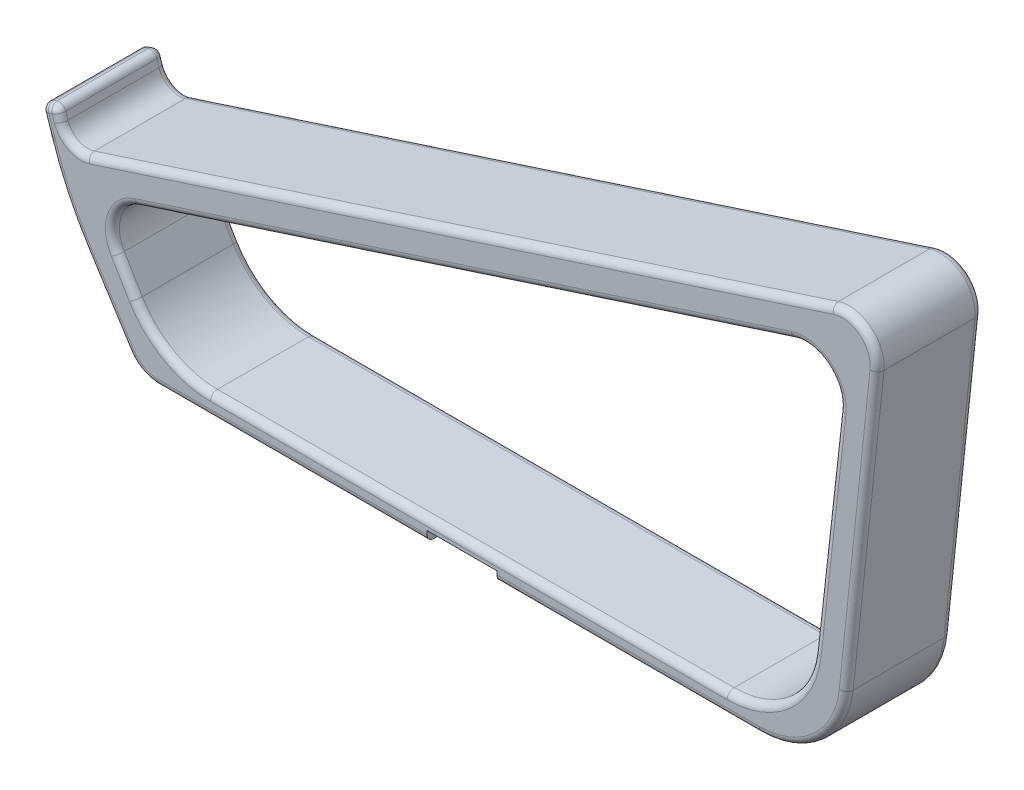
from build123d import *

# Parameters (mm, degrees)
SKETCH2_W           = 250
SKETCH2_H           = 30
BOSS_EXTRUDE1_DEPTH = 10
SKETCH3_W           = 5
SKETCH3_H           = 30
BOSS_EXTRUDE2_DEPTH = 10
SKETCH4_W           = 200
SKETCH4_H           = 30
BOSS_EXTRUDE3_DEPTH = 6
SKETCH11_W          = 30
SKETCH11_H          = 55
CUT_EXTRUDE2_DEPTH  = 10
FILLET1_R           = 25
FILLET9_R           = 10
FILLET8_R           = 10
FILLET11_R          = 25
FILLET5_R           = 6
FILLET10_R          = 100
FILLET6_R           = 2
SKETCH12_W          = 20
SKETCH12_H          = 20
SKETCH12_W_2        = 5
SKETCH12_H_2        = 7.5
CUT_EXTRUDE3_DEPTH  = 3


with BuildPart() as part:
    # Sketch2 → Boss-Extrude1 (new body)
    with BuildSketch(Plane(origin=(-23.43534086, 72.126562752, 0), x_dir=(0.9510565162951534, 0.3090169943749482, 0), z_dir=(-0.3090169943749481, 0.9510565162951533, 0))):
        with Locations((33.98053096, 100)):
            Rectangle(SKETCH2_W, SKETCH2_H)
    extrude(amount=-BOSS_EXTRUDE1_DEPTH)

    # Sketch3 → Boss-Extrude2 (add)
    with BuildSketch(Plane(origin=(-23.43534086, 72.126562752, 0), x_dir=(0.9510565162951534, 0.3090169943749482, 0), z_dir=(-0.3090169943749481, 0.9510565162951533, 0))):
        with Locations((-88.51946904, 100)):
            Rectangle(SKETCH3_W, SKETCH3_H)
    extrude(amount=BOSS_EXTRUDE2_DEPTH)



with BuildPart() as body_2:
    # Sketch4 → Boss-Extrude3 (new body)
    with BuildSketch(Plane(origin=(0, 0, 0), x_dir=(1, 0, 0), z_dir=(0, 1, 0))):
        with Locations((15, 100)):
            Rectangle(SKETCH4_W, SKETCH4_H)
    extrude(amount=BOSS_EXTRUDE3_DEPTH)


with BuildPart() as part_1:
    add(part.part)

    add(body_2.part)  # Loft1 merges body 2
    # Sketch6 → Loft1 section 0
    with BuildSketch(Plane(origin=(-23.43534086, 72.126562752, 0), x_dir=(0.9510565162951534, 0.3090169943749482, 0), z_dir=(0.3090169943749481, -0.9510565162951533, 0))):
        with BuildLine():
            Line((158.98053096, -85), (148.98053096, -85))
            Line((148.98053096, -85), (148.98053096, -115))
            Line((148.98053096, -115), (158.98053096, -115))
            Line((158.98053096, -115), (158.98053096, -85))
        make_face()
    # Sketch5 → Loft1 section 1
    with BuildSketch(Plane(origin=(0, 0, 0), x_dir=(1, 0, 0), z_dir=(0, 1, 0))):
        with BuildLine():
            Line((115, 115), (105, 115))
            Line((105, 115), (105, 85))
            Line((105, 85), (115, 85))
            Line((115, 85), (115, 115))
        make_face()
    loft()

    # Sketch11 → Cut-Extrude2 (cut)
    with BuildSketch(Plane(origin=(113.739623688, -11.973083454, 0), x_dir=(0, 0, -1), z_dir=(0.9945050055104876, -0.1046890348345292, 0))):
        with Locations((100, 135.5)):
            Rectangle(SKETCH11_W, SKETCH11_H)
    extrude(amount=CUT_EXTRUDE2_DEPTH, mode=Mode.SUBTRACT)

    # Sketch9 → Loft2 section 0
    with BuildSketch(Plane(origin=(-20.345170916, 62.615997589, 0), x_dir=(0.9510565162951534, 0.3090169943749482, 0), z_dir=(0.3090169943749481, -0.9510565162951533, 0))):
        with BuildLine():
            Line((-91.01946904, -85), (-81.01946904, -85))
            Line((-81.01946904, -85), (-81.01946904, -115))
            Line((-81.01946904, -115), (-91.01946904, -115))
            Line((-91.01946904, -115), (-91.01946904, -85))
        make_face()
    # Sketch10 → Loft2 section 1
    with BuildSketch(Plane(origin=(0, 0, 0), x_dir=(1, 0, 0), z_dir=(0, 1, 0))):
        with BuildLine():
            Line((-85, 115), (-75, 115))
            Line((-75, 115), (-75, 85))
            Line((-75, 85), (-85, 85))
            Line((-85, 85), (-85, 115))
        make_face()
    loft()

    # Fillet1
    fillet1_edges = [part_1.edges().sort_by_distance(p)[0] for p in [
        (105.672974261, 6, -100),
        (-78.576290654, 6, -100),
    ]]
    fillet(fillet1_edges, radius=FILLET1_R)

    # Fillet9
    fillet9_edges = [part_1.edges().sort_by_distance(p)[0] for p in [
        (127.764129074, 121.254248594, -100),
    ]]
    fillet(fillet9_edges, radius=FILLET9_R)

    # Fillet8
    fillet8_edges = [part_1.edges().sort_by_distance(p)[0] for p in [
        (117.029613529, 107.251770821, -100),
        (-97.399264893, 37.579604781, -100),
        (-85, 0, -100),
    ]]
    fillet(fillet8_edges, radius=FILLET8_R)

    # Fillet11
    fillet11_edges = [part_1.edges().sort_by_distance(p)[0] for p in [
        (115, 0, -100),
    ]]
    fillet(fillet11_edges, radius=FILLET11_R)

    # Fillet5
    fillet5_edges = [part_1.edges().sort_by_distance(p)[0] for p in [
        (-105.244717419, 45.545084972, -100),
    ]]
    fillet(fillet5_edges, radius=FILLET5_R)

    # Fillet10
    fillet10_edges = [part_1.edges().sort_by_distance(p)[0] for p in [
        (-106.909830056, 34.489434837, -100),
    ]]
    fillet(fillet10_edges, radius=FILLET10_R)

    # Fillet6
    fillet6_edges = [part_1.edges().sort_by_distance(p)[0] for p in [
        (9.473412371, 6, -115),
        (9.473412371, 6, -85),
        (-76.722563068, 9.262951119, -85),
        (-76.722563068, 9.262951119, -115),
        (99.983633439, 12.363146047, -85),
        (99.983633439, 12.363146047, -115),
        (121.753976282, 64.160140842, -85),
        (121.753976282, 64.160140842, -115),
        (6.789088019, 81.947075002, -85),
        (122.500555572, 114.755349451, -85),
        (122.500555572, 114.755349451, -115),
        (6.494058609, 0, -85),
        (-88.417020392, 22.509949594, -85),
        (8.392983609, 71.953590028, -85),
        (111.732266775, 60.02250459, -85),
        (-84.320965292, 1.235829976, -85),
        (8.392983609, 71.953590028, -115),
        (-88.417020392, 22.509949594, -115),
        (111.732266775, 60.02250459, -115),
        (-84.320965292, 1.235829976, -115),
        (-91.756560464, 35.458482469, -85),
        (-91.756560464, 35.458482469, -115),
        (111.682636246, 100.69569196, -115),
        (111.682636246, 100.69569196, -85),
        (-107.716853374, 53.153537102, -85),
        (-107.716853374, 53.153537102, -115),
        (-113.090169944, 53.510565163, -100),
        (-110.712528653, 54.283107649, -85),
        (-108.334887362, 55.055650135, -100),
        (6.494058609, 0, -115),
        (109.220318345, 6.420028972, -115),
        (-110.712528653, 54.283107649, -115),
        (109.220318345, 6.420028972, -85),
        (6.789088019, 81.947075002, -115),
        (-104.116423285, 47.759486891, -115),
        (-104.116423285, 47.759486891, -85),
        (-111.955491831, 50.018385015, -85),
        (-111.955491831, 50.018385015, -115),
        (-94.034829619, 14.222208325, -85),
        (-106.188112518, 34.829251267, -85),
        (-94.034829619, 14.222208325, -115),
        (-106.188112518, 34.829251267, -115),
    ]]
    fillet(fillet6_edges, radius=FILLET6_R)

    # Sketch12 → Cut-Extrude3 (cut)
    with BuildSketch(Plane.XZ):
        with Locations((7.494564149, -95)):
            Rectangle(SKETCH12_W, SKETCH12_H)
        with Locations((7.494564149, -95)):
            Rectangle(SKETCH12_W_2, SKETCH12_H_2, mode=Mode.SUBTRACT)
    extrude(amount=-CUT_EXTRUDE3_DEPTH, mode=Mode.SUBTRACT)


solid = part_1.part
